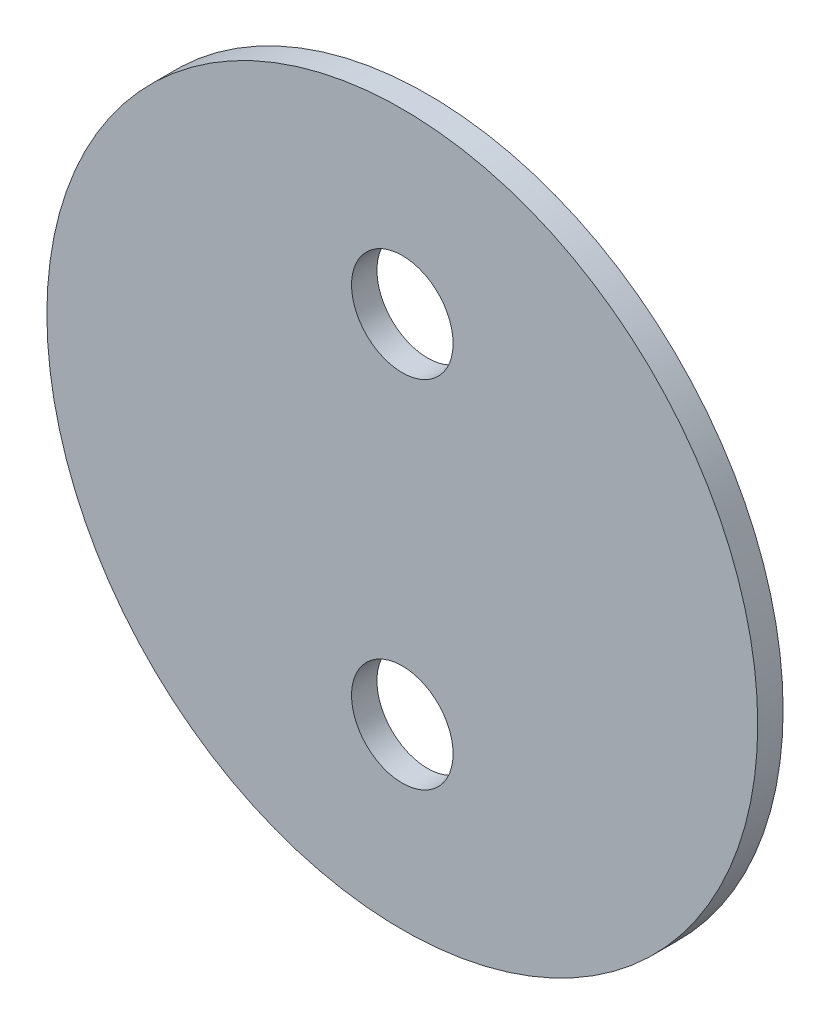
from build123d import *

# Parameters (mm, degrees)
SZKIC1_R   = 14
SZKIC1_R_2 = 2


with BuildPart() as part:
    # Wyciągnięcie po ścieżce3: sweep along a path in Szkic3
    with BuildLine(Plane(origin=(0, 0, 0), x_dir=(0, 0, -1), z_dir=(1, 0, 0))) as wyci_gni_cie_po_cie_ce3_path:
        Line((0, 0), (1, 0))
    # Szkic1 → Wyciągnięcie po ścieżce3 (sweep)
    with BuildSketch(Plane.XY):
        Circle(SZKIC1_R)
        with Locations((0, 7)):
            Circle(SZKIC1_R_2, mode=Mode.SUBTRACT)
        with Locations((0, -7)):
            Circle(SZKIC1_R_2, mode=Mode.SUBTRACT)
    sweep(path=wyci_gni_cie_po_cie_ce3_path.line)


solid = part.part
